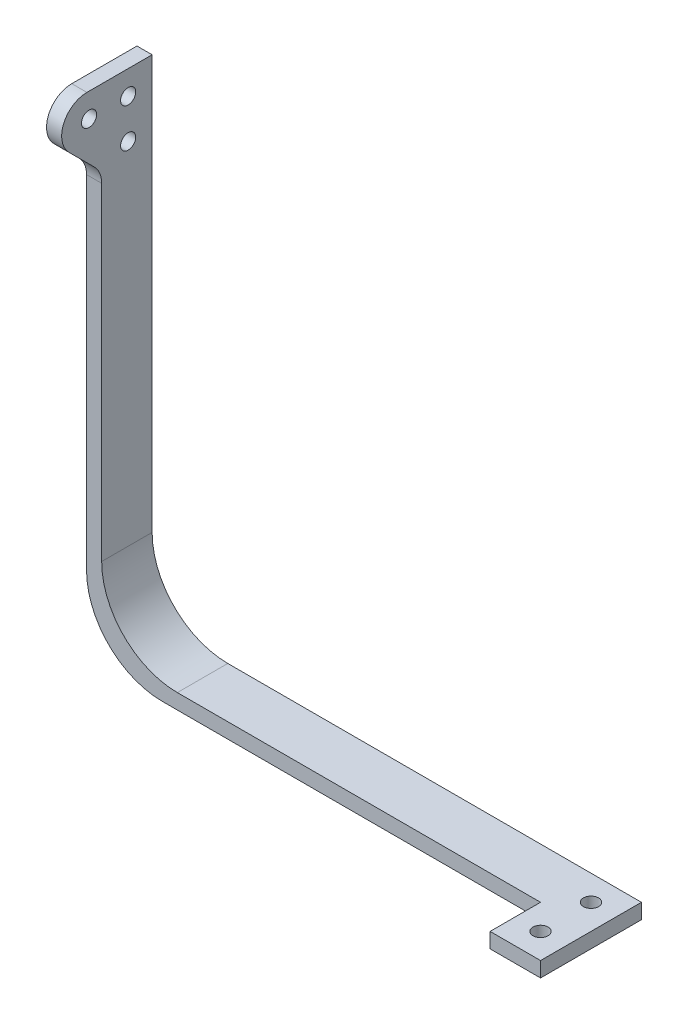
from build123d import *

# Parameters (mm, degrees)
BOSS_EXTRUDE1_DEPTH = 10
SKETCH2_W           = 10
SKETCH2_H           = 3
BOSS_EXTRUDE2_DEPTH = 10
SKETCH3_R           = 1.5
CUT_EXTRUDE1_DEPTH  = 3
FILLET1_R           = 15
SKETCH4_R           = 1.5
BOSS_EXTRUDE3_DEPTH = 3
FILLET2_R           = 5


with BuildPart() as part:
    # Sketch1 → Boss-Extrude1 (new body)
    with BuildSketch(Plane.XY):
        Polygon((0, 0), (100, 0), (100, 3), (3, 3), (3, 85), (0, 85), align=None)
    extrude(amount=BOSS_EXTRUDE1_DEPTH)

    # Sketch2 → Boss-Extrude2 (add)
    with BuildSketch(Plane.XY.offset(10)):
        with Locations((95, 1.5)):
            Rectangle(SKETCH2_W, SKETCH2_H)
    extrude(amount=BOSS_EXTRUDE2_DEPTH)

    # Sketch3 → Cut-Extrude1 (cut)
    with BuildSketch(Plane(origin=(0, 3, 0), x_dir=(1, 0, 0), z_dir=(0, 1, 0))):
        with Locations(Location((95, -5, 0), (0, 0, 270))):
            Circle(SKETCH3_R)
        with Locations(Location((95, -15, 0), (0, 0, 90))):
            Circle(SKETCH3_R)
    extrude(amount=-CUT_EXTRUDE1_DEPTH, mode=Mode.SUBTRACT)

    # Fillet1
    fillet1_edges = [part.edges().sort_by_distance(p)[0] for p in [
        (3, 3, 5),
        (0, 0, 5),
    ]]
    fillet(fillet1_edges, radius=FILLET1_R)

    # Sketch4 → Boss-Extrude3 (add)
    with BuildSketch(Plane(origin=(3, 0, 0), x_dir=(0, 0, -1), z_dir=(1, 0, 0))):
        Polygon((0, 100), (-25, 100), (0, 75), align=None)
        with Locations(Location((-12.5, 95.25, 0), (0, 0, 90))):
            Circle(SKETCH4_R, mode=Mode.SUBTRACT)
        with Locations(Location((-4.75, 95.25, 0), (0, 0, 90))):
            Circle(SKETCH4_R, mode=Mode.SUBTRACT)
        with Locations(Location((-4.75, 87.5, 0), (0, 0, 90))):
            Circle(SKETCH4_R, mode=Mode.SUBTRACT)
    extrude(amount=-BOSS_EXTRUDE3_DEPTH)

    # Fillet2
    fillet2_edges = [part.edges().sort_by_distance(p)[0] for p in [
        (1.5, 85, 10),
        (1.5, 100, 25),
    ]]
    fillet(fillet2_edges, radius=FILLET2_R)


solid = part.part
